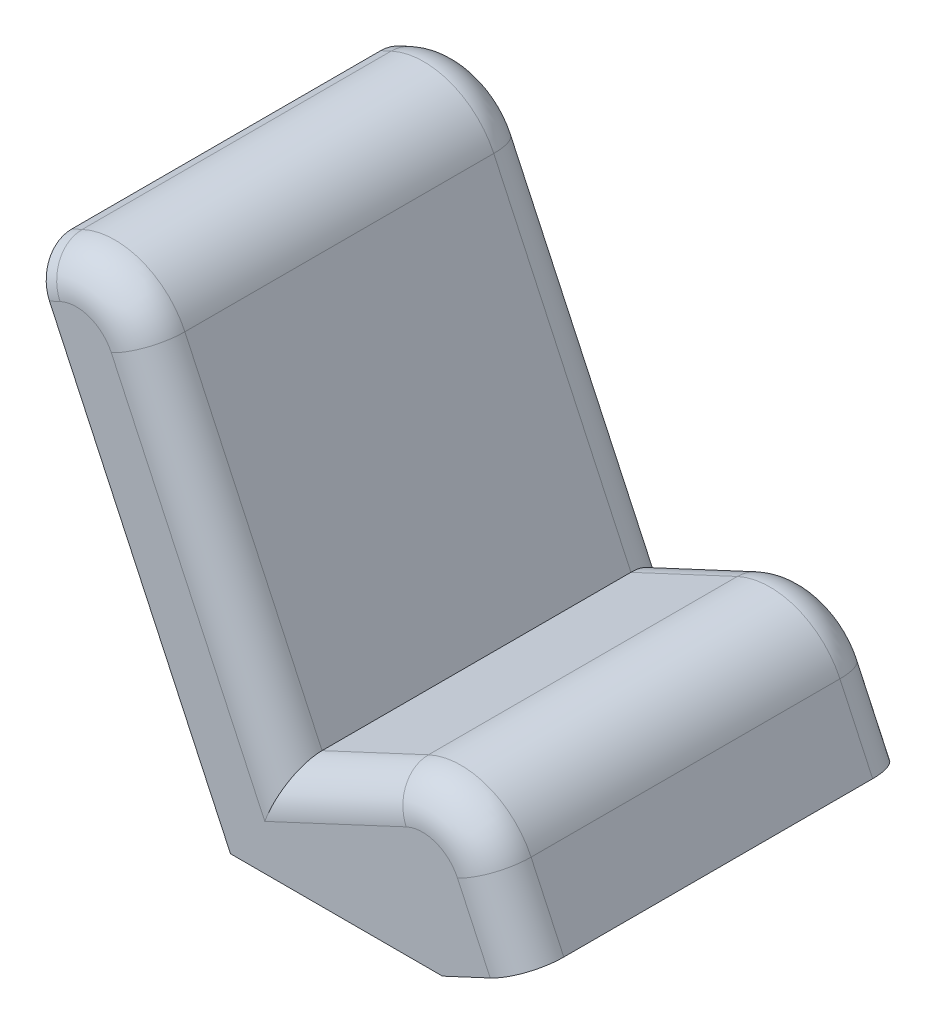
from build123d import *

# Parameters (mm, degrees)
BOSS_EXTRUDE1_DEPTH = 50
SKETCH4_R           = 7.5
BOSS_EXTRUDE2_DEPTH = 10
FILLET1_R           = 10
CHAMFER1_SIZE       = 2


with BuildPart() as part:
    # Sketch3 → Boss-Extrude1 (new, symmetric)
    with BuildSketch(Plane.XY):
        with BuildLine():
            Line((-50.714191409, 108.756934444), (0, 0))
            Line((0, 0), (57.1, 0))
            Line((57.1, 0), (78.545069205, 10))
            Line((78.545069205, 10), (70.068082541, 28.178956567))
            ThreePointArc((70.068082541, 28.178956567), (58.782329667, 38.520443748), (43.489561565, 37.852747073))
            Line((43.489561565, 37.852747073), (15.92675652, 25))
            Line((15.92675652, 25), (-19.604131498, 101.196235247))
            ThreePointArc((-19.604131498, 101.196235247), (-30.889884372, 111.537722428), (-46.182652474, 110.870025753))
            Line((-46.182652474, 110.870025753), (-50.714191409, 108.756934444))
        make_face()
    extrude(amount=BOSS_EXTRUDE1_DEPTH, both=True)

    # Sketch4 → Boss-Extrude2 (add)
    with BuildSketch(Plane.XZ):
        with Locations(Location((30, 0, 0), (0, 0, 90))):
            Circle(SKETCH4_R)
    extrude(amount=BOSS_EXTRUDE2_DEPTH)

    # Fillet1
    fillet1_edges = [part.edges().sort_by_distance(p)[0] for p in [
        (29.708159043, 31.426373536, -50),
        (58.782329667, 38.520443748, -50),
        (74.306575873, 19.089478283, -50),
        (-48.448421941, 109.813480099, -50),
        (74.306575873, 19.089478283, 50),
        (58.782329667, 38.520443748, 50),
        (29.708159043, 31.426373536, 50),
        (-1.838687489, 63.098117624, 50),
        (-30.889884372, 111.537722428, 50),
        (-48.448421941, 109.813480099, 50),
        (-30.889884372, 111.537722428, -50),
        (-1.838687489, 63.098117624, -50),
    ]]
    fillet(fillet1_edges, radius=FILLET1_R)

    # Chamfer1
    chamfer1_edges = [part.edges().sort_by_distance(p)[0] for p in [
        (-23.244004396, 49.846928287, -50),
        (-23.244004396, 49.846928287, 50),
        (-50.714191409, 108.756934444, 0),
        (-49.476371179, 106.102420395, 47.071067812),
        (-49.476371179, 106.102420395, -47.071067812),
    ]]
    chamfer(chamfer1_edges, length=CHAMFER1_SIZE)


solid = part.part
